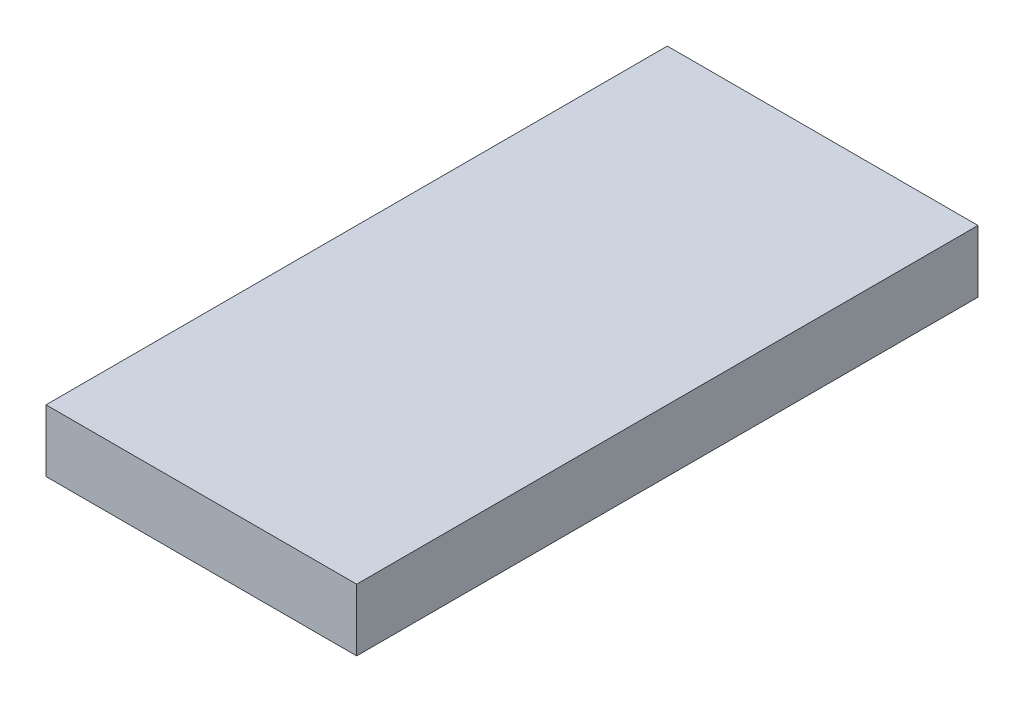
from build123d import *

# Parameters (mm, degrees)
SKETCH_1_W      = 20
SKETCH_1_H      = 40
EXTRUDE_1_DEPTH = 2


with BuildPart() as part:
    # Эскиз1 → Бобышка-Вытянуть1 (new, symmetric)
    with BuildSketch(Plane(origin=(0, 0, 0), x_dir=(1, 0, 0), z_dir=(0, 1, 0))):
        Rectangle(SKETCH_1_W, SKETCH_1_H)
    extrude(amount=EXTRUDE_1_DEPTH, both=True)


solid = part.part
